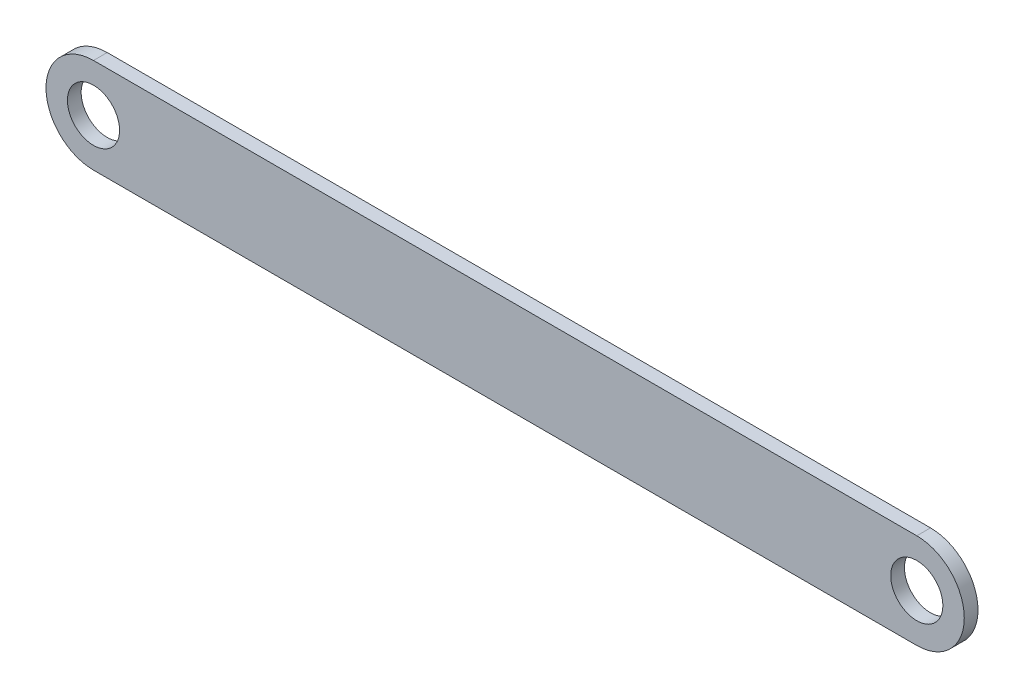
from build123d import *

# Parameters (mm, degrees)
SALIENTE_EXTRUIR1_DEPTH = 2.5
CROQUIS3_R              = 4.75
CORTAR_EXTRUIR1_DEPTH   = 85.137417536


with BuildPart() as part:
    # Croquis2 → Saliente-Extruir1 (new body)
    with BuildSketch(Plane.XY):
        with BuildLine():
            Line((-75, 8.653846154), (75, 8.653846154))
            ThreePointArc((75, 8.653846154), (83.653846154, 0), (75, -8.653846154))
            Line((75, -8.653846154), (-75, -8.653846154))
            ThreePointArc((-75, -8.653846154), (-83.653846154, 0), (-75, 8.653846154))
        make_face()
    extrude(amount=SALIENTE_EXTRUIR1_DEPTH)

    # Croquis3 → Cortar-Extruir1 (cut, through all)
    with BuildSketch(Plane.XY.offset(2.5)):
        with Locations((-75, 0)):
            Circle(CROQUIS3_R)
        with Locations((75, 0)):
            Circle(CROQUIS3_R)
    extrude(amount=-CORTAR_EXTRUIR1_DEPTH, mode=Mode.SUBTRACT)


solid = part.part
